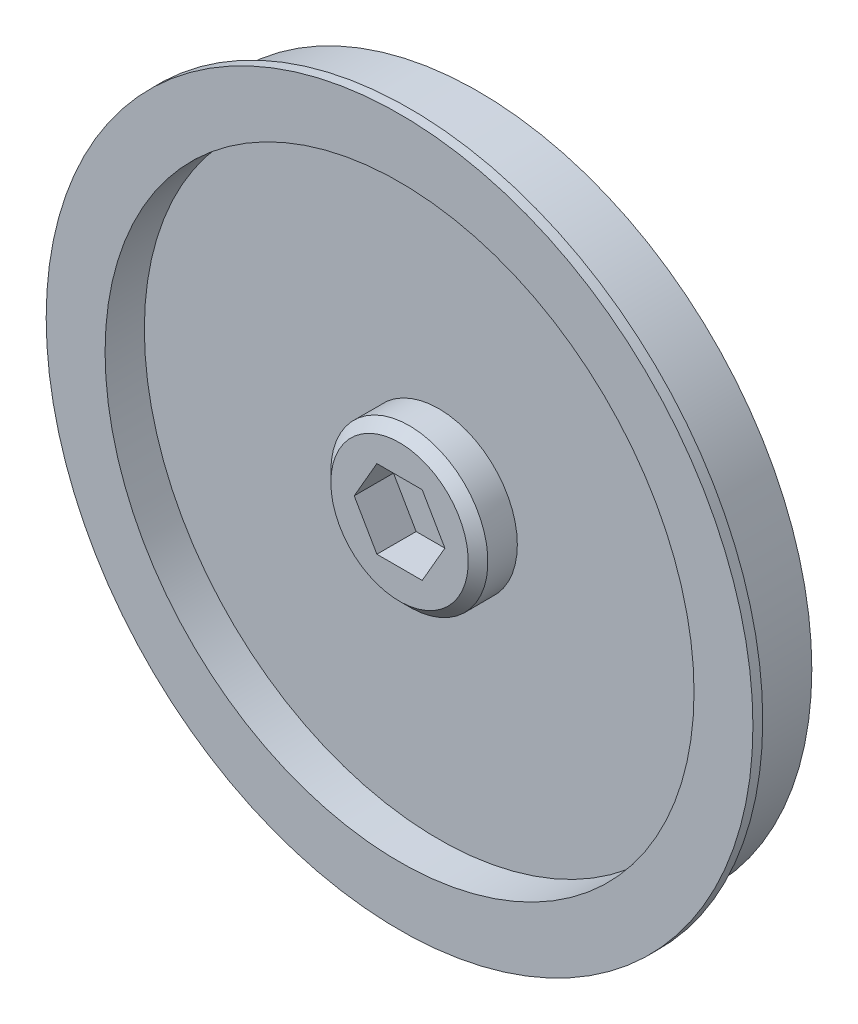
from build123d import *

# Parameters (mm, degrees)
SKETCH1_R           = 53.975
BOSS_EXTRUDE1_DEPTH = 11.1125
SKETCH2_R           = 57.15
BOSS_EXTRUDE2_DEPTH = 1.5875
SKETCH3_R           = 47.625
CUT_EXTRUDE1_DEPTH  = 6.35
SKETCH4_R           = 12.7
BOSS_EXTRUDE3_DEPTH = 6.35
CHAMFER2_SIZE       = 1.5875


with BuildPart() as part:
    # Sketch1 → Boss-Extrude1 (new body)
    with BuildSketch(Plane.XY):
        Circle(SKETCH1_R)
    extrude(amount=BOSS_EXTRUDE1_DEPTH)

    # Sketch2 → Boss-Extrude2 (add)
    with BuildSketch(Plane.XY.offset(11.1125)):
        Circle(SKETCH2_R)
    extrude(amount=BOSS_EXTRUDE2_DEPTH)

    # Sketch3 → Cut-Extrude1 (cut)
    with BuildSketch(Plane.XY.offset(12.7)):
        Circle(SKETCH3_R)
    extrude(amount=-CUT_EXTRUDE1_DEPTH, mode=Mode.SUBTRACT)

    # Sketch4 → Boss-Extrude3 (add)
    with BuildSketch(Plane.XY.offset(6.35)):
        Circle(SKETCH4_R)
        Polygon((7.332348419, 0), (3.666174209, 6.35), (-3.666174209, 6.35), (-7.332348419, 0), (-3.666174209, -6.35), (3.666174209, -6.35), align=None, mode=Mode.SUBTRACT)
    extrude(amount=BOSS_EXTRUDE3_DEPTH)

    # Chamfer2
    chamfer2_edges = [part.edges().sort_by_distance(p)[0] for p in [
        (-12.7, 0, 12.7),
    ]]
    chamfer(chamfer2_edges, length=CHAMFER2_SIZE)


solid = part.part
